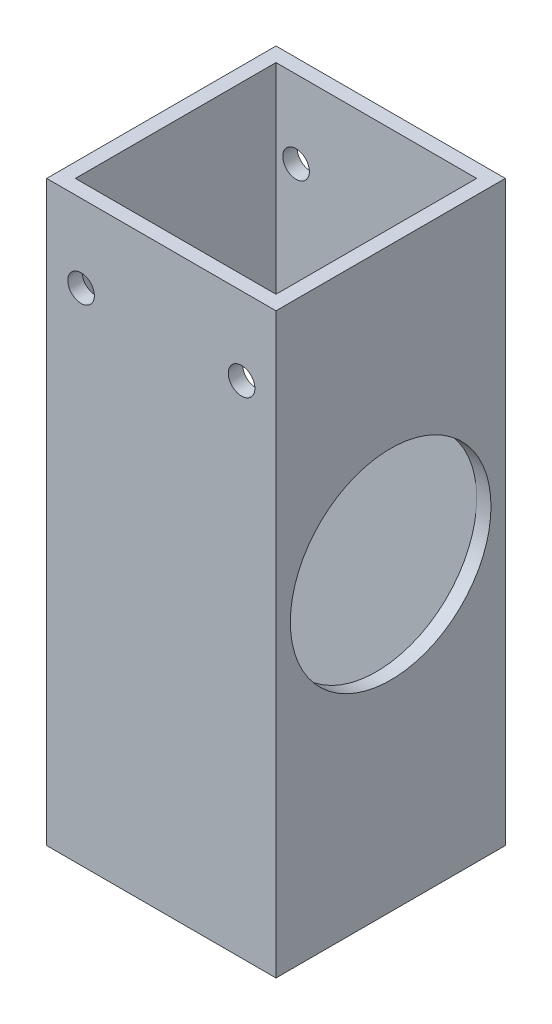
from build123d import *

# Parameters (mm, degrees)
SKETCH1_W               = 25.4
SKETCH1_H               = 25.4
SKETCH1_W_2             = 22.225
SKETCH1_H_2             = 22.225
BOSS_EXTRUDE1_DEPTH     = 63.99895
SKETCH3_R               = 11.1125
CUT_EXTRUDE2_DEPTH      = 71.016538054
CUT_EXTRUDE3_DEPTH      = 71.016538054
CUT_EXTRUDE3_DEPTH_BACK = 71.016538054
SKETCH6_R               = 1.4732
CUT_EXTRUDE4_DEPTH      = 71.016538054
CUT_EXTRUDE4_DEPTH_BACK = 71.016538054
SKETCH7_R               = 1.4732


with BuildPart() as part:
    # Sketch1 → Boss-Extrude1 (new body)
    with BuildSketch(Plane(origin=(0, 0, 0), x_dir=(1, 0, 0), z_dir=(0, 1, 0))):
        Rectangle(SKETCH1_W, SKETCH1_H)
        Rectangle(SKETCH1_W_2, SKETCH1_H_2, mode=Mode.SUBTRACT)
    extrude(amount=BOSS_EXTRUDE1_DEPTH)

    # Sketch3 → Cut-Extrude2 (cut, through all)
    with BuildSketch(Plane(origin=(12.7, 0, 0), x_dir=(0, 0, -1), z_dir=(1, 0, 0))):
        with Locations((0, 33.3375)):
            Circle(SKETCH3_R)
    extrude(amount=-CUT_EXTRUDE2_DEPTH, mode=Mode.SUBTRACT)

    # Sketch6 → Cut-Extrude3 (cut, two sides: drawn at the far end of the back side and taken through both)
    with BuildSketch(Plane(origin=(0, 0, -12.7), x_dir=(-1, 0, 0), z_dir=(0, 0, -1)).offset(-CUT_EXTRUDE3_DEPTH_BACK)):
        with Locations((8.889941847, 55.381049815)):
            Circle(SKETCH6_R)
    extrude(amount=CUT_EXTRUDE3_DEPTH + CUT_EXTRUDE3_DEPTH_BACK, mode=Mode.SUBTRACT)

    # Sketch7 → Cut-Extrude4 (cut, two sides: drawn at the far end of the back side and taken through both)
    with BuildSketch(Plane(origin=(0, 0, -12.7), x_dir=(-1, 0, 0), z_dir=(0, 0, -1)).offset(-CUT_EXTRUDE4_DEPTH_BACK)):
        with Locations((-8.889941847, 55.381049816)):
            Circle(SKETCH7_R)
    extrude(amount=CUT_EXTRUDE4_DEPTH + CUT_EXTRUDE4_DEPTH_BACK, mode=Mode.SUBTRACT)


solid = part.part
